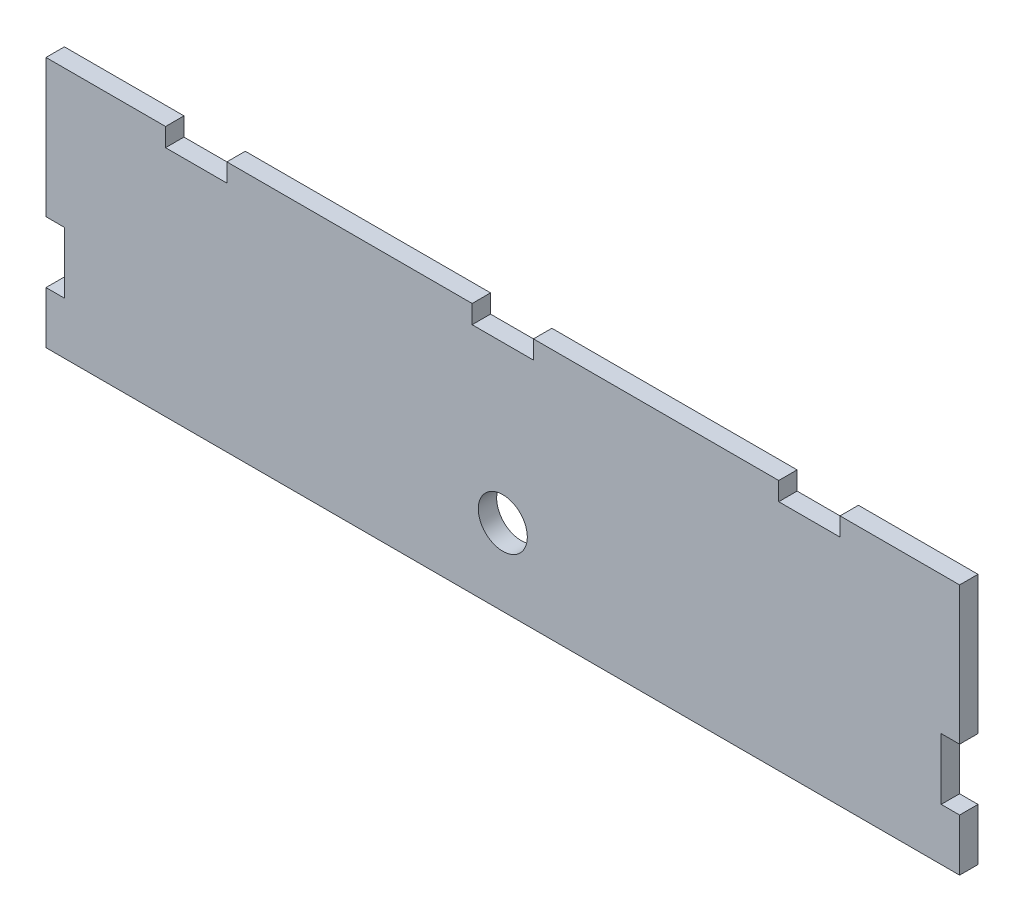
from build123d import *

# Parameters (mm, degrees)
BOSS_EXTRUDE1_DEPTH = 3
SKETCH2_R           = 4
CUT_EXTRUDE1_DEPTH  = 80.298486745


with BuildPart() as part:
    # Sketch1 → Boss-Extrude1 (new body)
    with BuildSketch(Plane.XY):
        Polygon((-74.5, 14), (-74.5, -8.5), (-71.5, -8.5), (-71.5, -18.5), (-74.5, -18.5), (-74.5, -27), (74.5, -27), (74.5, -18.5), (71.5, -18.5), (71.5, -8.5), (74.5, -8.5), (74.5, 14), (55, 14), (55, 11), (45, 11), (45, 14), (5, 14), (5, 11), (-5, 11), (-5, 14), (-45, 14), (-45, 11), (-55, 11), (-55, 14), align=None)
    extrude(amount=BOSS_EXTRUDE1_DEPTH)

    # Sketch2 → Cut-Extrude1 (cut, through all)
    with BuildSketch(Plane.XY):
        with Locations((0, -14.5)):
            Circle(SKETCH2_R)
    extrude(amount=CUT_EXTRUDE1_DEPTH, mode=Mode.SUBTRACT)


solid = part.part
